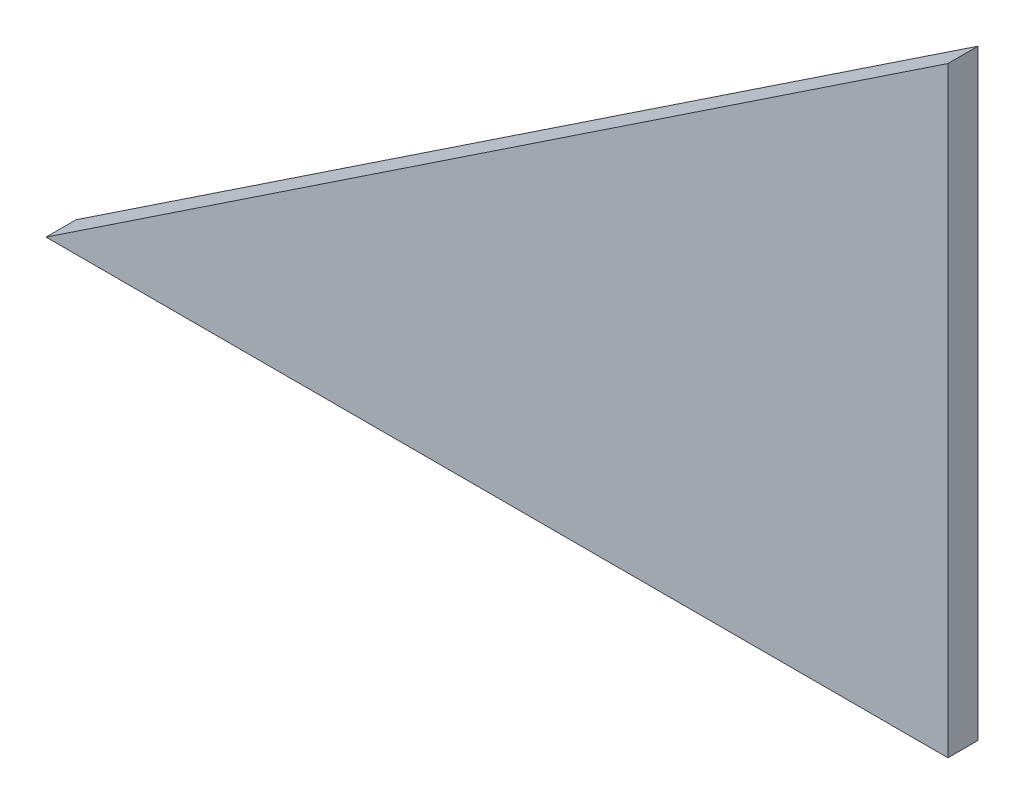
from build123d import *

# Parameters (mm, degrees)
BOSS_EXTRUDE1_DEPTH = 1.27


with BuildPart() as part:
    # Sketch1 → Boss-Extrude1 (new body)
    with BuildSketch(Plane(origin=(0, 0, 23.676486755), x_dir=(-1, 0, 0), z_dir=(0, 0, -1))):
        Polygon((-235.036631061, 11.960081074), (-235.036631061, 37.360081074), (-196.936631061, 11.960081074), align=None)
    extrude(amount=BOSS_EXTRUDE1_DEPTH)


solid = part.part
